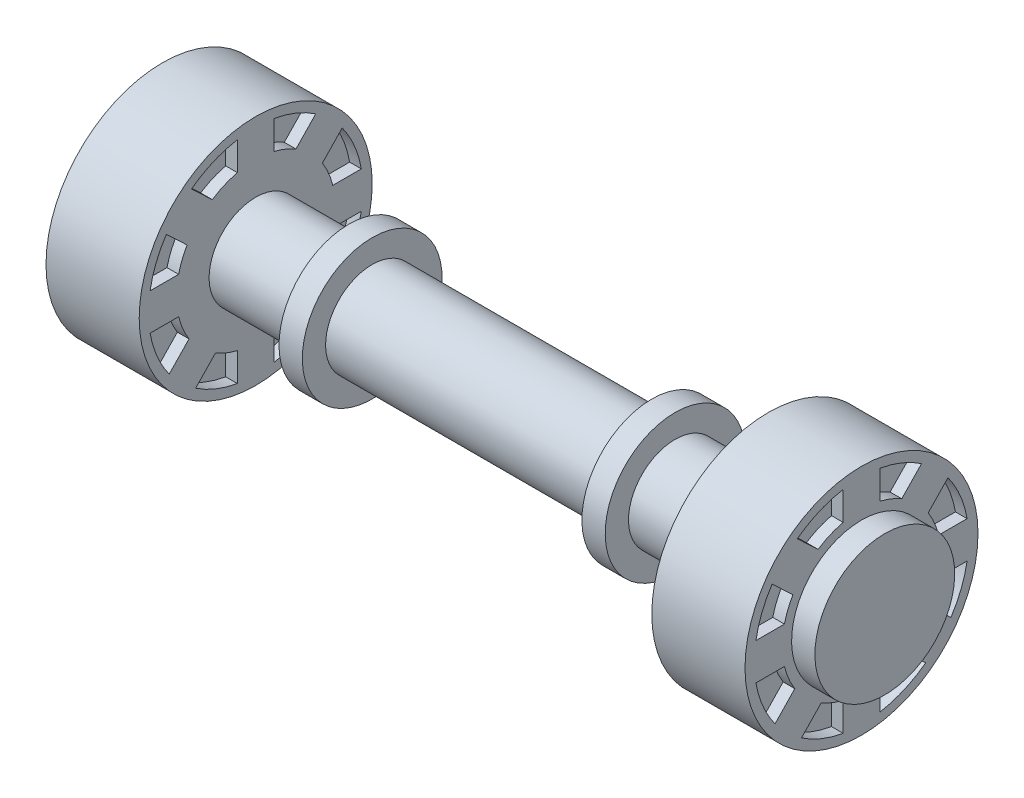
from build123d import *

# Parameters (mm, degrees)
CUT_EXTRUDE1_DEPTH = 6.35
CUT_EXTRUDE2_START = -6.35
CUT_EXTRUDE2_DEPTH = 6.35
SKETCH4_W          = 2.54
SKETCH4_H          = 33.02
CUT_EXTRUDE3_DEPTH = 6.35
CUT_EXTRUDE4_START = -6.35
CUT_EXTRUDE4_DEPTH = 6.35


with BuildPart() as part:
    # Sketch1 → Revolve1 (revolve)
    with BuildSketch(Plane.XY):
        Polygon((203.2, 0), (-203.2, 0), (-203.2, 38.1), (-190.5, 38.1), (-190.5, 63.5), (-139.7, 63.5), (-139.7, 25.4), (-88.9, 25.4), (-88.9, 38.1), (-76.2, 38.1), (-76.2, 25.4), (76.2, 25.4), (76.2, 38.1), (88.9, 38.1), (88.9, 25.4), (139.7, 25.4), (139.7, 63.5), (190.5, 63.5), (190.5, 38.1), (203.2, 38.1), align=None)
    revolve(axis=Axis((203.2, 0, 0), (-1, 0, 0)))

    # Sketch2 → Cut-Extrude1 (cut)
    with BuildSketch(Plane(origin=(190.5, 0, 0), x_dir=(0, 0, -1), z_dir=(1, 0, 0))):
        with BuildLine():
            Line((-23.672751536, 36.112508009), (-34.979017414, 46.790648005))
            ThreePointArc((-34.979017414, 46.790648005), (-23.124893688, 53.648258983), (-10, 57.557765766))
            Line((-10, 57.557765766), (-10, 42.006099557))
            ThreePointArc((-10, 42.006099557), (-17.092312726, 39.653060987), (-23.672751536, 36.112508009))
        make_face()
        with BuildLine():
            Line((-42.006099557, 10), (-57.557765766, 10))
            ThreePointArc((-57.557765766, 10), (-54.286816867, 21.583278584), (-48.711488073, 32.250384954))
            Line((-48.711488073, 32.250384954), (-37.405222195, 21.572244958))
            ThreePointArc((-37.405222195, 21.572244958), (-40.125038554, 15.952858084), (-42.006099557, 10))
        make_face()
        with BuildLine():
            Line((-36.345847153, -23.312910474), (-47.135755533, -34.51256221))
            ThreePointArc((-47.135755533, -34.51256221), (-53.762438347, -22.858185032), (-57.557765766, -10))
            Line((-57.557765766, -10), (-42.006099557, -10))
            ThreePointArc((-42.006099557, -10), (-39.737454431, -16.895180241), (-36.345847153, -23.312910474))
        make_face()
        with BuildLine():
            Line((-10, -42.006099557), (-10, -57.557765766))
            ThreePointArc((-10, -57.557765766), (-21.852607087, -54.17896237), (-32.732602088, -48.388771017))
            Line((-32.732602088, -48.388771017), (-21.942693708, -37.18911928))
            ThreePointArc((-21.942693708, -37.18911928), (-16.151926977, -40.045320013), (-10, -42.006099557))
        make_face()
        with BuildLine():
            Line((48.711488073, -32.250384954), (37.405222195, -21.572244958))
            ThreePointArc((37.405222195, -21.572244958), (40.125038554, -15.952858084), (42.006099557, -10))
            Line((42.006099557, -10), (57.557765766, -10))
            ThreePointArc((57.557765766, -10), (54.286816867, -21.583278584), (48.711488073, -32.250384954))
        make_face()
        with BuildLine():
            Line((57.557765766, 10), (42.006099557, 10))
            ThreePointArc((42.006099557, 10), (39.737454431, 16.895180241), (36.345847153, 23.312910474))
            Line((36.345847153, 23.312910474), (47.135755533, 34.51256221))
            ThreePointArc((47.135755533, 34.51256221), (53.762438347, 22.858185032), (57.557765766, 10))
        make_face()
        with BuildLine():
            Line((32.732602088, 48.388771017), (21.942693708, 37.18911928))
            ThreePointArc((21.942693708, 37.18911928), (16.151926977, 40.045320013), (10, 42.006099557))
            Line((10, 42.006099557), (10, 57.557765766))
            ThreePointArc((10, 57.557765766), (21.852607087, 54.17896237), (32.732602088, 48.388771017))
        make_face()
        with BuildLine():
            Line((10, -42.006099557), (10, -57.557765766))
            ThreePointArc((10, -57.557765766), (23.124893688, -53.648258983), (34.979017414, -46.790648005))
            Line((34.979017414, -46.790648005), (23.672751536, -36.112508009))
            ThreePointArc((23.672751536, -36.112508009), (17.092312726, -39.653060987), (10, -42.006099557))
        make_face()
    extrude(amount=-CUT_EXTRUDE1_DEPTH, mode=Mode.SUBTRACT)

    # Sketch3 → Cut-Extrude2 (cut)
    with BuildSketch(Plane.ZY.offset(190.5).offset(CUT_EXTRUDE2_START)):
        with BuildLine():
            Line((57.557765766, 10), (42.006099557, 10))
            ThreePointArc((42.006099557, 10), (40.125038554, 15.952858084), (37.405222195, 21.572244958))
            Line((37.405222195, 21.572244958), (48.711488073, 32.250384954))
            ThreePointArc((48.711488073, 32.250384954), (54.286816867, 21.583278584), (57.557765766, 10))
        make_face()
        with BuildLine():
            Line((47.135755533, -34.51256221), (36.345847153, -23.312910474))
            ThreePointArc((36.345847153, -23.312910474), (39.737454431, -16.895180241), (42.006099557, -10))
            Line((42.006099557, -10), (57.557765766, -10))
            ThreePointArc((57.557765766, -10), (53.762438347, -22.858185032), (47.135755533, -34.51256221))
        make_face()
        with BuildLine():
            Line((10, -57.557765766), (10, -42.006099557))
            ThreePointArc((10, -42.006099557), (16.151926977, -40.045320013), (21.942693708, -37.18911928))
            Line((21.942693708, -37.18911928), (32.732602088, -48.388771017))
            ThreePointArc((32.732602088, -48.388771017), (21.852607087, -54.17896237), (10, -57.557765766))
        make_face()
        with BuildLine():
            Line((-34.979017414, -46.790648005), (-23.672751536, -36.112508009))
            ThreePointArc((-23.672751536, -36.112508009), (-17.092312726, -39.653060987), (-10, -42.006099557))
            Line((-10, -42.006099557), (-10, -57.557765766))
            ThreePointArc((-10, -57.557765766), (-23.124893688, -53.648258983), (-34.979017414, -46.790648005))
        make_face()
        with BuildLine():
            Line((-57.557765766, -10), (-42.006099557, -10))
            ThreePointArc((-42.006099557, -10), (-40.125038554, -15.952858084), (-37.405222195, -21.572244958))
            Line((-37.405222195, -21.572244958), (-48.711488073, -32.250384954))
            ThreePointArc((-48.711488073, -32.250384954), (-54.286816867, -21.583278584), (-57.557765766, -10))
        make_face()
        with BuildLine():
            Line((-47.135755533, 34.51256221), (-36.345847153, 23.312910474))
            ThreePointArc((-36.345847153, 23.312910474), (-39.737454431, 16.895180241), (-42.006099557, 10))
            Line((-42.006099557, 10), (-57.557765766, 10))
            ThreePointArc((-57.557765766, 10), (-53.762438347, 22.858185032), (-47.135755533, 34.51256221))
        make_face()
        with BuildLine():
            Line((-10, 57.557765766), (-10, 42.006099557))
            ThreePointArc((-10, 42.006099557), (-16.151926977, 40.045320013), (-21.942693708, 37.18911928))
            Line((-21.942693708, 37.18911928), (-32.732602088, 48.388771017))
            ThreePointArc((-32.732602088, 48.388771017), (-21.852607087, 54.17896237), (-10, 57.557765766))
        make_face()
        with BuildLine():
            Line((34.979017414, 46.790648005), (23.672751536, 36.112508009))
            ThreePointArc((23.672751536, 36.112508009), (17.092312726, 39.653060987), (10, 42.006099557))
            Line((10, 42.006099557), (10, 57.557765766))
            ThreePointArc((10, 57.557765766), (23.124893688, 53.648258983), (34.979017414, 46.790648005))
        make_face()
    extrude(amount=CUT_EXTRUDE2_DEPTH, mode=Mode.SUBTRACT)

    # Sketch4 → Cut-Revolve1 (revolve, cut)
    with BuildSketch(Plane.XY, mode=Mode.PRIVATE) as cut_revolve1_sk:
        with Locations((196.85, 16.51)):
            Rectangle(SKETCH4_W, SKETCH4_H)
        Polygon((134.62, 20.32), (134.62, 0), (-134.62, 0), (-134.62, 20.32), (-83.82, 20.32), (-83.82, 33.02), (-81.28, 33.02), (-81.28, 20.32), (81.28, 20.32), (81.28, 33.02), (83.82, 33.02), (83.82, 20.32), align=None)
        with Locations((-196.85, 16.51)):
            Rectangle(SKETCH4_W, SKETCH4_H)
    revolve(cut_revolve1_sk.sketch.rotate(Axis((-139.7, 0, 0), (1, 0, 0)), 180), axis=Axis((-139.7, 0, 0), (1, 0, 0)), mode=Mode.SUBTRACT)

    # Sketch5 → Cut-Extrude3 (cut)
    with BuildSketch(Plane(origin=(-139.7, 0, 0), x_dir=(0, 0, -1), z_dir=(1, 0, 0))):
        with BuildLine():
            Line((57.557765766, 10), (42.006099557, 10))
            ThreePointArc((42.006099557, 10), (39.737454431, 16.895180241), (36.345847153, 23.312910474))
            Line((36.345847153, 23.312910474), (47.135755533, 34.51256221))
            ThreePointArc((47.135755533, 34.51256221), (53.762438347, 22.858185032), (57.557765766, 10))
        make_face()
        with BuildLine():
            Line((48.711488073, -32.250384954), (37.405222195, -21.572244958))
            ThreePointArc((37.405222195, -21.572244958), (40.125038554, -15.952858084), (42.006099557, -10))
            Line((42.006099557, -10), (57.557765766, -10))
            ThreePointArc((57.557765766, -10), (54.286816867, -21.583278584), (48.711488073, -32.250384954))
        make_face()
        with BuildLine():
            Line((10, -57.557765766), (10, -42.006099557))
            ThreePointArc((10, -42.006099557), (17.092312726, -39.653060987), (23.672751536, -36.112508009))
            Line((23.672751536, -36.112508009), (34.979017414, -46.790648005))
            ThreePointArc((34.979017414, -46.790648005), (23.124893688, -53.648258983), (10, -57.557765766))
        make_face()
        with BuildLine():
            Line((-32.732602088, -48.388771017), (-21.942693708, -37.18911928))
            ThreePointArc((-21.942693708, -37.18911928), (-16.151926977, -40.045320013), (-10, -42.006099557))
            Line((-10, -42.006099557), (-10, -57.557765766))
            ThreePointArc((-10, -57.557765766), (-21.852607087, -54.17896237), (-32.732602088, -48.388771017))
        make_face()
        with BuildLine():
            Line((-57.557765766, -10), (-42.006099557, -10))
            ThreePointArc((-42.006099557, -10), (-39.737454431, -16.895180241), (-36.345847153, -23.312910474))
            Line((-36.345847153, -23.312910474), (-47.135755533, -34.51256221))
            ThreePointArc((-47.135755533, -34.51256221), (-53.762438347, -22.858185032), (-57.557765766, -10))
        make_face()
        with BuildLine():
            Line((-48.711488073, 32.250384954), (-37.405222195, 21.572244958))
            ThreePointArc((-37.405222195, 21.572244958), (-40.125038554, 15.952858084), (-42.006099557, 10))
            Line((-42.006099557, 10), (-57.557765766, 10))
            ThreePointArc((-57.557765766, 10), (-54.286816867, 21.583278584), (-48.711488073, 32.250384954))
        make_face()
        with BuildLine():
            Line((-10, 57.557765766), (-10, 42.006099557))
            ThreePointArc((-10, 42.006099557), (-17.092312726, 39.653060987), (-23.672751536, 36.112508009))
            Line((-23.672751536, 36.112508009), (-34.979017414, 46.790648005))
            ThreePointArc((-34.979017414, 46.790648005), (-23.124893688, 53.648258983), (-10, 57.557765766))
        make_face()
        with BuildLine():
            Line((32.732602088, 48.388771017), (21.942693708, 37.18911928))
            ThreePointArc((21.942693708, 37.18911928), (16.151926977, 40.045320013), (10, 42.006099557))
            Line((10, 42.006099557), (10, 57.557765766))
            ThreePointArc((10, 57.557765766), (21.852607087, 54.17896237), (32.732602088, 48.388771017))
        make_face()
    extrude(amount=-CUT_EXTRUDE3_DEPTH, mode=Mode.SUBTRACT)

    # Sketch6 → Cut-Extrude4 (cut)
    with BuildSketch(Plane.ZY.offset(-139.7).offset(CUT_EXTRUDE4_START)):
        with BuildLine():
            Line((48.711488073, 32.250384954), (37.405222195, 21.572244958))
            ThreePointArc((37.405222195, 21.572244958), (40.125038554, 15.952858084), (42.006099557, 10))
            Line((42.006099557, 10), (57.557765766, 10))
            ThreePointArc((57.557765766, 10), (54.286816867, 21.583278584), (48.711488073, 32.250384954))
        make_face()
        with BuildLine():
            Line((57.557765766, -10), (42.006099557, -10))
            ThreePointArc((42.006099557, -10), (39.737454431, -16.895180241), (36.345847153, -23.312910474))
            Line((36.345847153, -23.312910474), (47.135755533, -34.51256221))
            ThreePointArc((47.135755533, -34.51256221), (53.762438347, -22.858185032), (57.557765766, -10))
        make_face()
        with BuildLine():
            Line((32.732602088, -48.388771017), (21.942693708, -37.18911928))
            ThreePointArc((21.942693708, -37.18911928), (16.151926977, -40.045320013), (10, -42.006099557))
            Line((10, -42.006099557), (10, -57.557765766))
            ThreePointArc((10, -57.557765766), (21.852607087, -54.17896237), (32.732602088, -48.388771017))
        make_face()
        with BuildLine():
            Line((-10, -57.557765766), (-10, -42.006099557))
            ThreePointArc((-10, -42.006099557), (-17.092312726, -39.653060987), (-23.672751536, -36.112508009))
            Line((-23.672751536, -36.112508009), (-34.979017414, -46.790648005))
            ThreePointArc((-34.979017414, -46.790648005), (-23.124893688, -53.648258983), (-10, -57.557765766))
        make_face()
        with BuildLine():
            Line((-48.711488073, -32.250384954), (-37.405222195, -21.572244958))
            ThreePointArc((-37.405222195, -21.572244958), (-40.125038554, -15.952858084), (-42.006099557, -10))
            Line((-42.006099557, -10), (-57.557765766, -10))
            ThreePointArc((-57.557765766, -10), (-54.286816867, -21.583278584), (-48.711488073, -32.250384954))
        make_face()
        with BuildLine():
            Line((-57.557765766, 10), (-42.006099557, 10))
            ThreePointArc((-42.006099557, 10), (-39.737454431, 16.895180241), (-36.345847153, 23.312910474))
            Line((-36.345847153, 23.312910474), (-47.135755533, 34.51256221))
            ThreePointArc((-47.135755533, 34.51256221), (-53.762438347, 22.858185032), (-57.557765766, 10))
        make_face()
        with BuildLine():
            Line((-32.732602088, 48.388771017), (-21.942693708, 37.18911928))
            ThreePointArc((-21.942693708, 37.18911928), (-16.151926977, 40.045320013), (-10, 42.006099557))
            Line((-10, 42.006099557), (-10, 57.557765766))
            ThreePointArc((-10, 57.557765766), (-21.852607087, 54.17896237), (-32.732602088, 48.388771017))
        make_face()
        with BuildLine():
            Line((10, 57.557765766), (10, 42.006099557))
            ThreePointArc((10, 42.006099557), (17.092312726, 39.653060987), (23.672751536, 36.112508009))
            Line((23.672751536, 36.112508009), (34.979017414, 46.790648005))
            ThreePointArc((34.979017414, 46.790648005), (23.124893688, 53.648258983), (10, 57.557765766))
        make_face()
    extrude(amount=CUT_EXTRUDE4_DEPTH, mode=Mode.SUBTRACT)


solid = part.part
